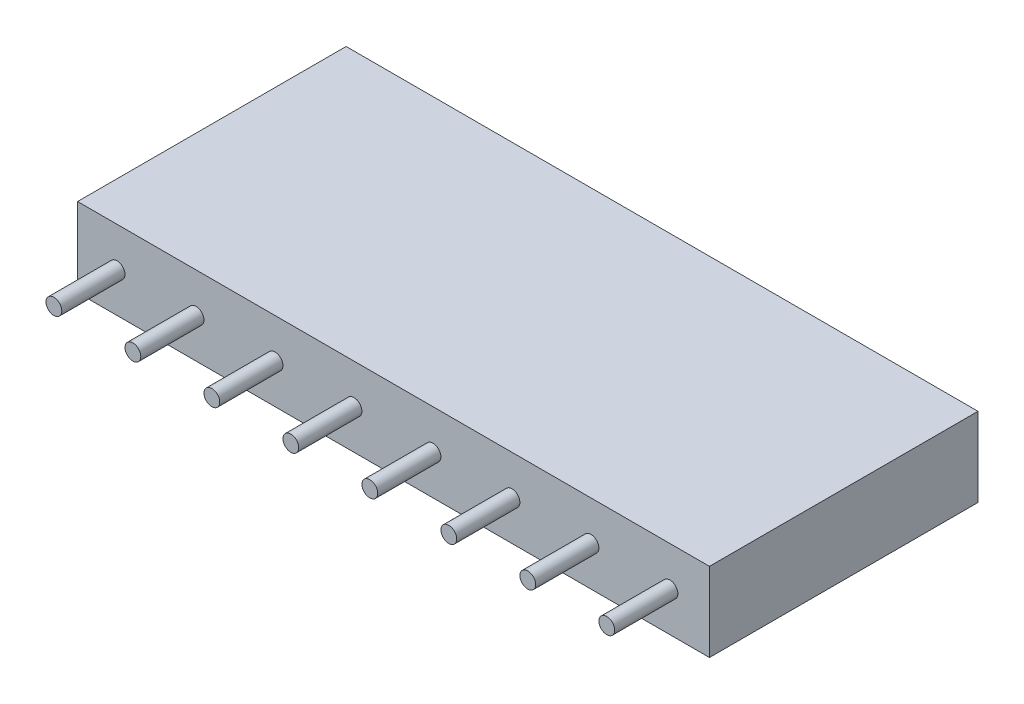
from build123d import *

# Parameters (mm, degrees)
ESQUISSE1_W                = 2.5
ESQUISSE1_H                = 2.5
BOSS_EXTRU_1_DEPTH         = 8.5
ESQUISSE2_R                = 0.25
BOSS_EXTRU_2_DEPTH         = 2
ESQUISSE3_R                = 0.25
ENL_V_MAT_EXTRU_2_DEPTH    = 4
R_P_TITION_LIN_AIRE1_COUNT = 8
R_P_TITION_LIN_AIRE1_PITCH = 2.5


with BuildPart() as part:
    # Esquisse1 → Boss.-Extru.1 (new body)
    with BuildSketch(Plane.XY):
        with Locations((-1.25, 1.25)):
            Rectangle(ESQUISSE1_W, ESQUISSE1_H)
    boss_extru_1 = extrude(amount=BOSS_EXTRU_1_DEPTH)

    # Esquisse2 → Boss.-Extru.2 (add)
    with BuildSketch(Plane.XY.offset(8.5)):
        with Locations((-1.25, 1.25)):
            Circle(ESQUISSE2_R)
    boss_extru_2 = extrude(amount=BOSS_EXTRU_2_DEPTH)

    # Esquisse3 → Enlèv. mat.-Extru.2 (cut)
    with BuildSketch(Plane(origin=(0, 0, 0), x_dir=(-1, 0, 0), z_dir=(0, 0, -1))):
        with Locations(Location((1.25, 1.25, 0), (0, 0, 180))):
            Circle(ESQUISSE3_R)
    enl_v_mat_extru_2 = extrude(amount=-ENL_V_MAT_EXTRU_2_DEPTH, mode=Mode.SUBTRACT)

    # Répétition linéaire1: Boss.-Extru.1, Boss.-Extru.2, Enlèv. mat.-Extru.2 ×8
    with Locations(*[(-i * R_P_TITION_LIN_AIRE1_PITCH, 0, 0) for i in range(1, R_P_TITION_LIN_AIRE1_COUNT)]):
        add(boss_extru_1)
        add(boss_extru_2)
        add(enl_v_mat_extru_2, mode=Mode.SUBTRACT)


solid = part.part
